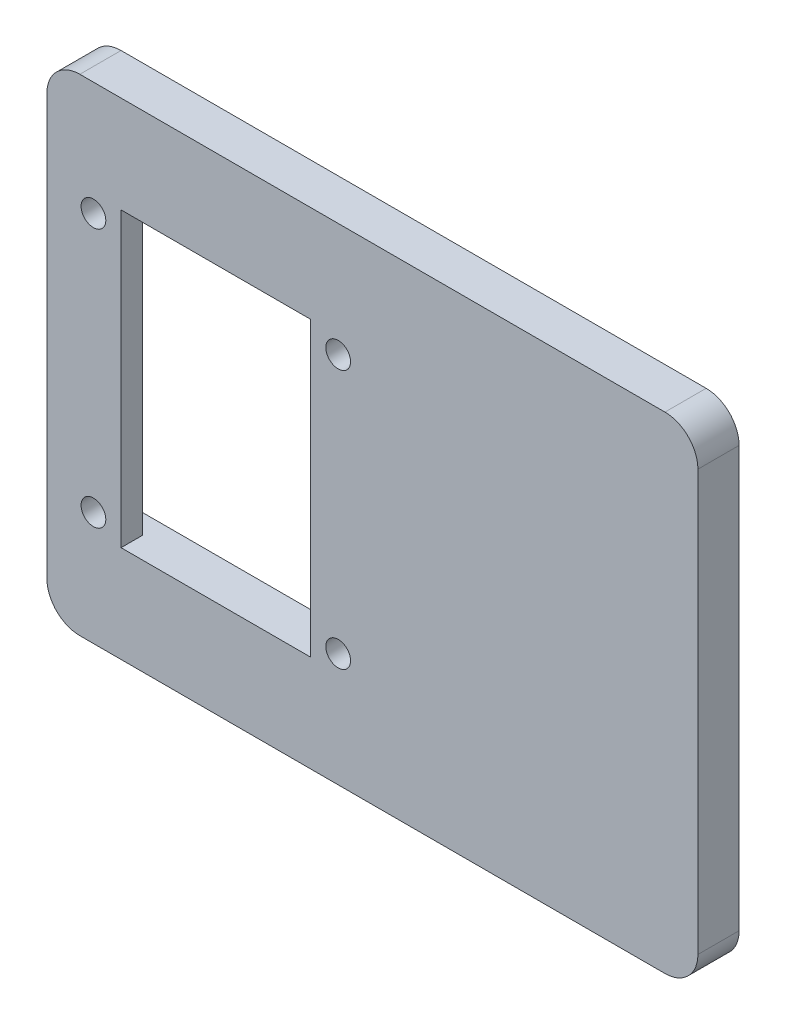
from build123d import *

# Parameters (mm, degrees)
SKETCH1_W           = 79
SKETCH1_H           = 59
BOSS_EXTRUDE1_DEPTH = 5
SKETCH2_R           = 1.5
SKETCH2_W           = 23
SKETCH2_H           = 17.75
CUT_EXTRUDE1_DEPTH  = 2.6
SKETCH3_W           = 33.7
SKETCH3_H           = 35.5
CUT_EXTRUDE2_DEPTH  = 2.4
FILLET1_R           = 4


with BuildPart() as part:
    # Sketch1 → Boss-Extrude1 (new body)
    with BuildSketch(Plane.XY):
        Rectangle(SKETCH1_W, SKETCH1_H)
    extrude(amount=BOSS_EXTRUDE1_DEPTH)

    # Sketch2 → Cut-Extrude1 (cut)
    with BuildSketch(Plane.XY.offset(5)):
        with Locations((-4.15, 15.71)):
            Circle(SKETCH2_R)
        with Locations((-4.15, -15.71)):
            Circle(SKETCH2_R)
        with Locations((-33.85, -15.71)):
            Circle(SKETCH2_R)
        with Locations((-33.85, 15.71)):
            Circle(SKETCH2_R)
        with Locations((-19, -8.875)):
            Rectangle(SKETCH2_W, SKETCH2_H)
        with Locations((-19, 8.875)):
            Rectangle(SKETCH2_W, SKETCH2_H)
    extrude(amount=-CUT_EXTRUDE1_DEPTH, mode=Mode.SUBTRACT)

    # Sketch3 → Cut-Extrude2 (cut)
    with BuildSketch(Plane(origin=(0, 0, 0), x_dir=(-1, 0, 0), z_dir=(0, 0, -1))):
        with Locations((19, 0)):
            Rectangle(SKETCH3_W, SKETCH3_H)
    extrude(amount=-CUT_EXTRUDE2_DEPTH, mode=Mode.SUBTRACT)

    # Fillet1
    fillet1_edges = [part.edges().sort_by_distance(p)[0] for p in [
        (39.5, -29.5, 2.5),
        (-39.5, -29.5, 2.5),
        (-39.5, 29.5, 2.5),
        (39.5, 29.5, 2.5),
    ]]
    fillet(fillet1_edges, radius=FILLET1_R)


solid = part.part
